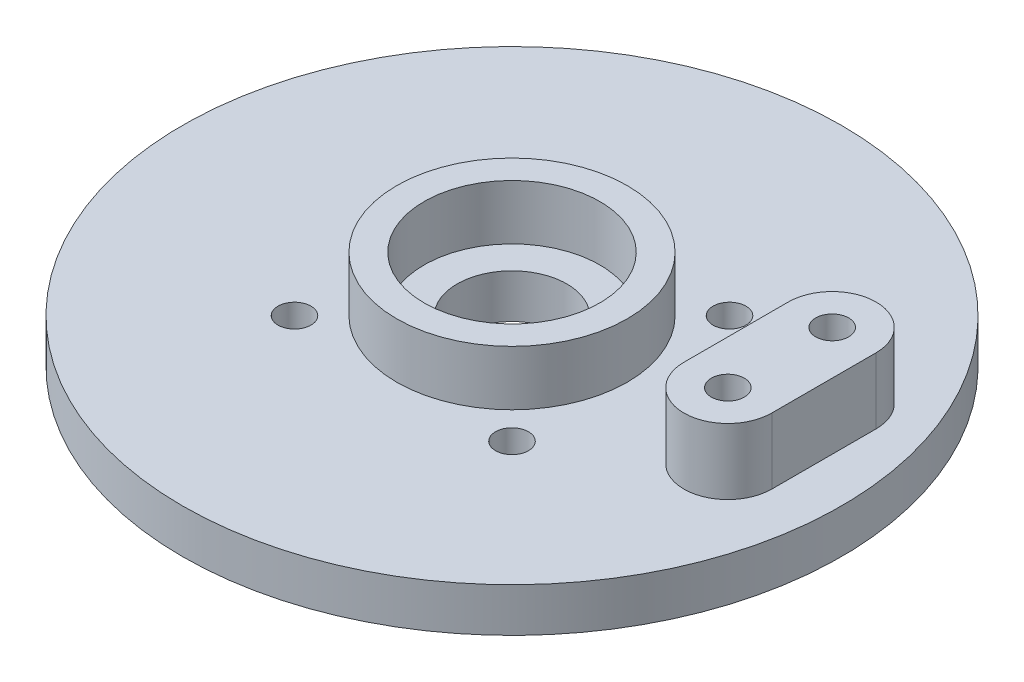
from build123d import *

# Parameters (mm, degrees)
CROQUIS1_R              = 30
SALIENTE_EXTRUIR1_DEPTH = 4
CROQUIS2_R              = 10.5
CROQUIS2_R_2            = 8
SALIENTE_EXTRUIR2_DEPTH = 5
CROQUIS4_R              = 5
CROQUIS4_R_2            = 1.5
CORTAR_EXTRUIR1_DEPTH   = 43.720018727
CROQUIS5_R              = 1.5
SALIENTE_EXTRUIR3_DEPTH = 6
CROQUIS6_R              = 1.5
CORTAR_EXTRUIR4_DEPTH   = 44.588989435


with BuildPart() as part:
    # Croquis1 → Saliente-Extruir1 (new body)
    with BuildSketch(Plane(origin=(0, 0, 0), x_dir=(1, 0, 0), z_dir=(0, 1, 0))):
        with Locations(Location((0, 0, 0), (0, 0, 270))):
            Circle(CROQUIS1_R)
    extrude(amount=SALIENTE_EXTRUIR1_DEPTH)

    # Croquis2 → Saliente-Extruir2 (add)
    with BuildSketch(Plane(origin=(0, 4, 0), x_dir=(1, 0, 0), z_dir=(0, 1, 0))):
        with Locations(Location((0, 0, 0), (0, 0, 270))):
            Circle(CROQUIS2_R)
        with Locations(Location((0, 0, 0), (0, 0, 270))):
            Circle(CROQUIS2_R_2, mode=Mode.SUBTRACT)
    extrude(amount=SALIENTE_EXTRUIR2_DEPTH)

    # Croquis4 → Cortar-Extruir1 (cut, through all)
    with BuildSketch(Plane(origin=(0, 4, 0), x_dir=(1, 0, 0), z_dir=(0, 1, 0))):
        with Locations(Location((0, 0, 0), (0, 0, 270))):
            Circle(CROQUIS4_R)
        with Locations(Location((-9.9, 9.9, 0), (0, 0, 270))):
            Circle(CROQUIS4_R_2)
        with Locations(Location((9.9, 9.9, 0), (0, 0, 270))):
            Circle(CROQUIS4_R_2)
        with Locations(Location((9.9, -9.9, 0), (0, 0, 270))):
            Circle(CROQUIS4_R_2)
        with Locations(Location((-9.9, -9.9, 0), (0, 0, 270))):
            Circle(CROQUIS4_R_2)
    extrude(amount=-CORTAR_EXTRUIR1_DEPTH, mode=Mode.SUBTRACT)

    # Croquis5 → Saliente-Extruir3 (add)
    with BuildSketch(Plane(origin=(0, 4, 0), x_dir=(1, 0, 0), z_dir=(0, 1, 0))):
        with BuildLine():
            Line((17.5, -1.853490575), (17.5, 7.646509425))
            ThreePointArc((17.5, 7.646509425), (21.5, 11.646509425), (25.5, 7.646509425))
            Line((25.5, 7.646509425), (25.5, -1.853490575))
            ThreePointArc((25.5, -1.853490575), (21.5, -5.853490575), (17.5, -1.853490575))
        make_face()
        with Locations(Location((21.5, 7.646509425, 0), (0, 0, 270))):
            Circle(CROQUIS5_R, mode=Mode.SUBTRACT)
        with Locations(Location((21.5, -1.853490575, 0), (0, 0, 270))):
            Circle(CROQUIS5_R, mode=Mode.SUBTRACT)
    extrude(amount=SALIENTE_EXTRUIR3_DEPTH)

    # Croquis6 → Cortar-Extruir4 (cut, through all)
    with BuildSketch(Plane(origin=(0, 10, 0), x_dir=(1, 0, 0), z_dir=(0, 1, 0))):
        with Locations(Location((21.5, 7.646509425, 0), (0, 0, 270))):
            Circle(CROQUIS6_R)
        with Locations(Location((21.5, -1.853490575, 0), (0, 0, 270))):
            Circle(CROQUIS6_R)
    extrude(amount=-CORTAR_EXTRUIR4_DEPTH, mode=Mode.SUBTRACT)


solid = part.part
